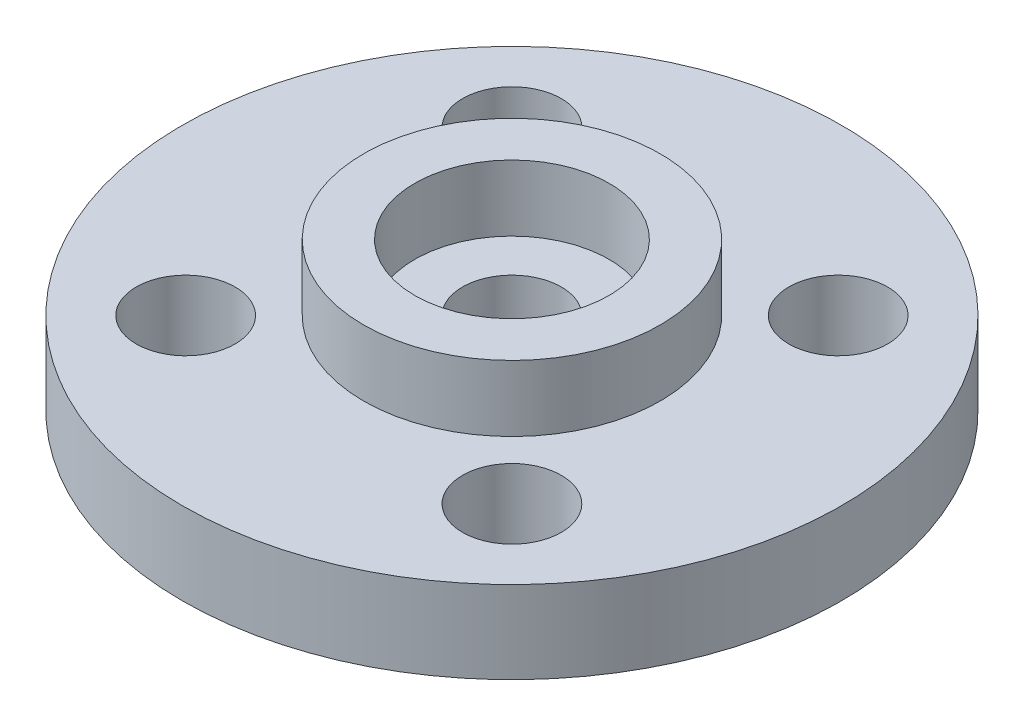
from build123d import *

# Parameters (mm, degrees)
SKETCH_1_R      = 10
SKETCH_1_R_2    = 1.5
EXTRUDE_1_DEPTH = 2.5
SKETCH_2_R      = 4.5
SKETCH_2_R_2    = 2.95
EXTRUDE_2_DEPTH = 2


with BuildPart() as part:
    # 草图1 → 凸台-拉伸1 (new body)
    with BuildSketch(Plane(origin=(0, 0, 0), x_dir=(1, 0, 0), z_dir=(0, 1, 0))):
        with Locations(Location((0, 0, 0), (0, 0, 270))):
            Circle(SKETCH_1_R)
        with Locations(Location((-4.949747468, 4.949747468, 0), (0, 0, 270))):
            Circle(SKETCH_1_R_2, mode=Mode.SUBTRACT)
        with Locations(Location((-4.949747468, -4.949747468, 0), (0, 0, 270))):
            Circle(SKETCH_1_R_2, mode=Mode.SUBTRACT)
        with Locations(Location((4.949747468, -4.949747468, 0), (0, 0, 270))):
            Circle(SKETCH_1_R_2, mode=Mode.SUBTRACT)
        with Locations(Location((0, 0, 0), (0, 0, 270))):
            Circle(SKETCH_1_R_2, mode=Mode.SUBTRACT)
        with Locations(Location((4.949747468, 4.949747468, 0), (0, 0, 270))):
            Circle(SKETCH_1_R_2, mode=Mode.SUBTRACT)
    extrude(amount=EXTRUDE_1_DEPTH)

    # 草图2 → 凸台-拉伸2 (add)
    with BuildSketch(Plane(origin=(0, 2.5, 0), x_dir=(1, 0, 0), z_dir=(0, 1, 0))):
        with Locations(Location((0, 0, 0), (0, 0, 270))):
            Circle(SKETCH_2_R)
        with Locations(Location((0, 0, 0), (0, 0, 270))):
            Circle(SKETCH_2_R_2, mode=Mode.SUBTRACT)
    extrude(amount=EXTRUDE_2_DEPTH)


solid = part.part
